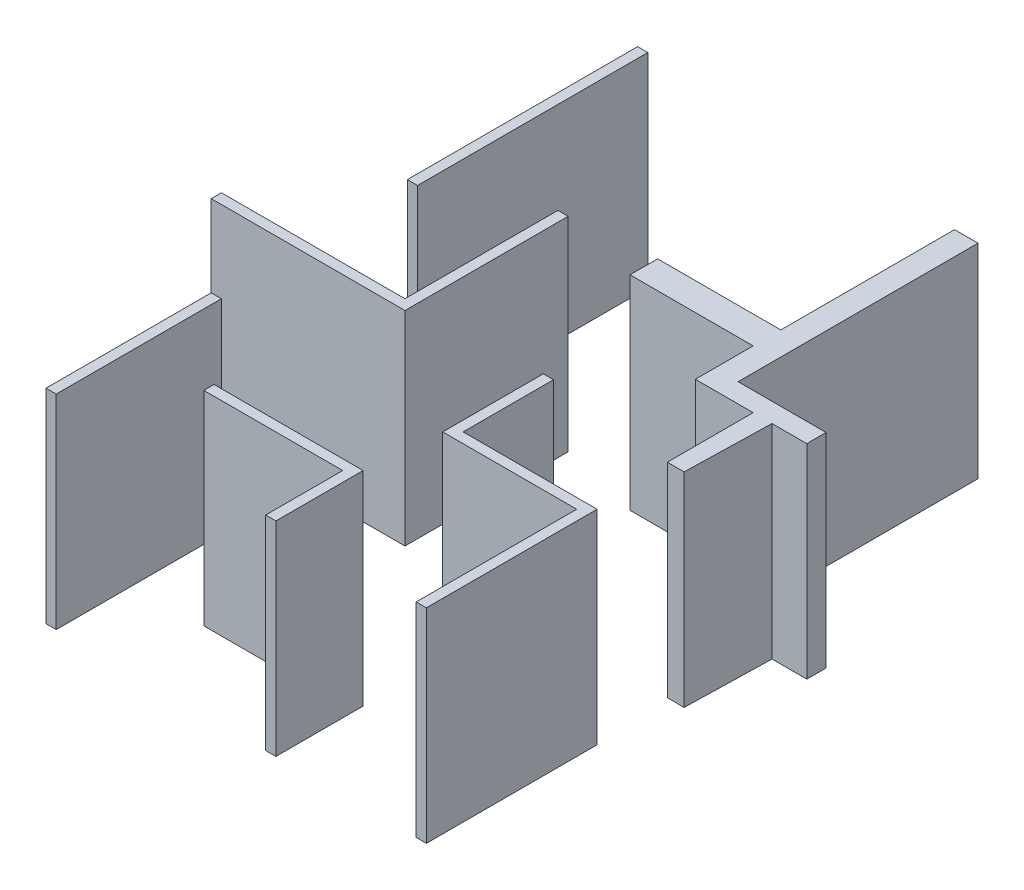
from build123d import *

# Parameters (mm, degrees)
SKETCH9_W            = 500
SKETCH9_H            = 8096.755147093
BOSS_EXTRUDE5_DEPTH  = 10000
BOSS_EXTRUDE6_DEPTH  = 10000
BOSS_EXTRUDE7_DEPTH  = 10000
BOSS_EXTRUDE8_DEPTH  = 10000
BOSS_EXTRUDE9_DEPTH  = 10000
SKETCH14_W           = 500
SKETCH14_H           = 11287.545399206
BOSS_EXTRUDE10_DEPTH = 10000


with BuildPart() as part:
    # Sketch9 → Boss-Extrude5 (new body)
    with BuildSketch(Plane(origin=(0, 0, 0), x_dir=(1, 0, 0), z_dir=(0, 1, 0))):
        with Locations((4750, 4548.377573547)):
            Rectangle(SKETCH9_W, SKETCH9_H)
    extrude(amount=BOSS_EXTRUDE5_DEPTH)


with BuildPart() as body_2:
    # Sketch1 → Boss-Extrude6 (new body)
    with BuildSketch(Plane(origin=(0, 0, 0), x_dir=(1, 0, 0), z_dir=(0, 1, 0))):
        Polygon((8462.011757956, 4776.7457449), (15769.183881246, 4776.7457449), (15769.183881246, 500), (15269.183881246, 500), (15269.183881246, 4276.7457449), (8462.011757956, 4276.7457449), align=None)
    extrude(amount=BOSS_EXTRUDE6_DEPTH)


with BuildPart() as body_3:
    # Sketch11 → Boss-Extrude7 (new body)
    with BuildSketch(Plane(origin=(0, 0, 0), x_dir=(1, 0, 0), z_dir=(0, 1, 0))):
        Polygon((16579.401831089, 13298.67172662), (16579.401831089, 8868.468538599), (23146.603843365, 8868.468538599), (23146.603843365, 500), (22646.603843365, 500), (22646.603843365, 8368.468538599), (16079.401831089, 8368.468538599), (16079.401831089, 13298.67172662), align=None)
    extrude(amount=BOSS_EXTRUDE7_DEPTH)


with BuildPart() as body_4:
    # Sketch12 → Boss-Extrude8 (new body)
    with BuildSketch(Plane(origin=(0, 0, 0), x_dir=(1, 0, 0), z_dir=(0, 1, 0))):
        Polygon((20037.063886677, 29500), (20037.063886677, 20983.680435406), (14000, 20983.680435406), (14000, 19628.42119554), (20037.063886677, 19628.42119554), (20037.063886677, 16794.697330365), (22870.780995046, 16794.697330365), (22870.780995046, 12587.654768297), (23694.036844744, 12587.654768297), (23794.82814267, 16794.697330365), (25500, 16794.697330365), (25500, 17739.27195209), (21187.462413517, 17739.27195209), (21187.462413517, 29500), align=None)
    extrude(amount=BOSS_EXTRUDE8_DEPTH)


with BuildPart() as body_5:
    # Sketch13 → Boss-Extrude9 (new body)
    with BuildSketch(Plane(origin=(0, 0, 0), x_dir=(1, 0, 0), z_dir=(0, 1, 0))):
        Polygon((500, 13096.755147093), (9500, 13096.755147093), (9500, 20596.755147093), (10000, 20596.755147093), (10000, 12596.755147093), (500, 12596.755147093), align=None)
    extrude(amount=BOSS_EXTRUDE9_DEPTH)


with BuildPart() as body_6:
    # Sketch14 → Boss-Extrude10 (new body)
    with BuildSketch(Plane(origin=(0, 0, 0), x_dir=(1, 0, 0), z_dir=(0, 1, 0))):
        with Locations((4750, 23856.227300397)):
            Rectangle(SKETCH14_W, SKETCH14_H)
    extrude(amount=BOSS_EXTRUDE10_DEPTH)


solid = Compound([part.part, body_2.part, body_3.part, body_4.part, body_5.part, body_6.part])
